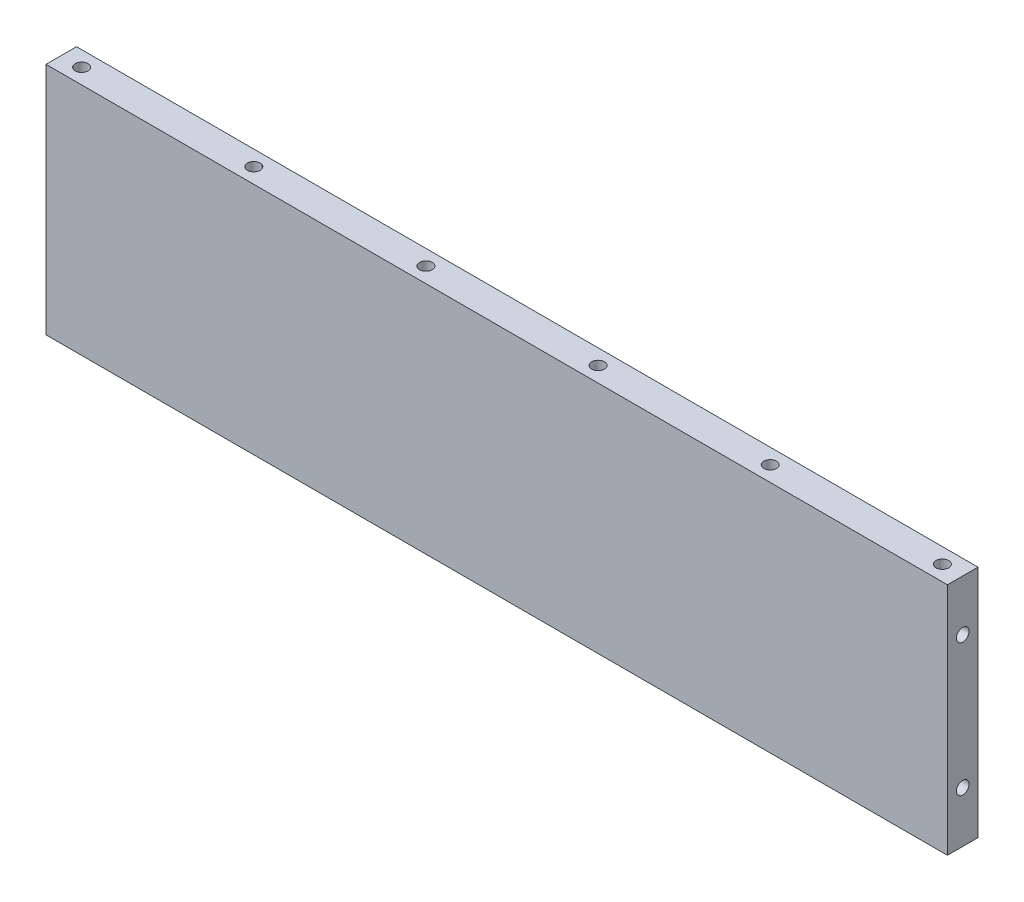
from build123d import *

# Parameters (mm, degrees)
SKETCH_1_W               = 177
SKETCH_1_H               = 46
EXTRUDE_1_DEPTH          = 3
M3X0_5_1_D               = 2.5
M3X0_5_1_DEPTH           = 8.5
M3X0_5_1_TIP             = 0.751075774
M3X0_5_1_ON_FACE_2_D     = 2.5
M3X0_5_1_ON_FACE_2_DEPTH = 8.5
M3X0_5_1_ON_FACE_2_TIP   = 0.751075774
M3X0_5_1_ON_FACE_3_D     = 2.5
M3X0_5_1_ON_FACE_3_DEPTH = 8.5
M3X0_5_1_ON_FACE_3_TIP   = 0.751075774
M3X0_5_1_ON_FACE_4_D     = 2.5
M3X0_5_1_ON_FACE_4_DEPTH = 8.5
M3X0_5_1_ON_FACE_4_TIP   = 0.751075774
CUT_EXTRUDE_1_DEPTH      = 4.8
FILLET_1_R               = 1.1


with BuildPart() as part:
    # ｽｹｯﾁ1 → ﾎﾞｽ - 押し出し1 (new, symmetric)
    with BuildSketch(Plane.XY):
        Rectangle(SKETCH_1_W, SKETCH_1_H)
    extrude(amount=EXTRUDE_1_DEPTH, both=True)

    # M3x0.5 ねじ穴1
    with Locations(Plane(origin=(84.5, -23, 0), x_dir=(0, 0, -1), z_dir=(0, -1, 0))):
        with Locations((0, 0), (0, -33.8), (0, -67.6), (0, -101.4), (0, -135.2), (0, -169)):
            Hole(M3X0_5_1_D / 2, depth=M3X0_5_1_DEPTH)
            with Locations((0, 0, -(M3X0_5_1_DEPTH + M3X0_5_1_TIP / 2))):  # 118° drill point
                Cone(0, M3X0_5_1_D / 2, M3X0_5_1_TIP, mode=Mode.SUBTRACT)

    # M3x0.5 ねじ穴1 on face 2
    with Locations(Plane(origin=(-88.5, -13, 0), x_dir=(0, 0, -1), z_dir=(-1, 0, 0))):
        with Locations((0, 0), (0, -26)):
            Hole(M3X0_5_1_ON_FACE_2_D / 2, depth=M3X0_5_1_ON_FACE_2_DEPTH)
            with Locations((0, 0, -(M3X0_5_1_ON_FACE_2_DEPTH + M3X0_5_1_ON_FACE_2_TIP / 2))):  # 118° drill point
                Cone(0, M3X0_5_1_ON_FACE_2_D / 2, M3X0_5_1_ON_FACE_2_TIP, mode=Mode.SUBTRACT)

    # M3x0.5 ねじ穴1 on face 3
    with Locations(Plane(origin=(-50.7, 23, 0), x_dir=(0, 0, 1), z_dir=(0, 1, 0))):
        with Locations((0, 0), (0, 33.8), (0, -33.8), (0, 67.6), (0, 101.4), (0, 135.2)):
            Hole(M3X0_5_1_ON_FACE_3_D / 2, depth=M3X0_5_1_ON_FACE_3_DEPTH)
            with Locations((0, 0, -(M3X0_5_1_ON_FACE_3_DEPTH + M3X0_5_1_ON_FACE_3_TIP / 2))):  # 118° drill point
                Cone(0, M3X0_5_1_ON_FACE_3_D / 2, M3X0_5_1_ON_FACE_3_TIP, mode=Mode.SUBTRACT)

    # M3x0.5 ねじ穴1 on face 4
    with Locations(Plane(origin=(88.5, 13, 0), x_dir=(0, 0, 1), z_dir=(1, 0, 0))):
        with Locations((0, 0), (0, 26)):
            Hole(M3X0_5_1_ON_FACE_4_D / 2, depth=M3X0_5_1_ON_FACE_4_DEPTH)
            with Locations((0, 0, -(M3X0_5_1_ON_FACE_4_DEPTH + M3X0_5_1_ON_FACE_4_TIP / 2))):  # 118° drill point
                Cone(0, M3X0_5_1_ON_FACE_4_D / 2, M3X0_5_1_ON_FACE_4_TIP, mode=Mode.SUBTRACT)

    # ｽｹｯﾁ4 → ｶｯﾄ - 押し出し1 (cut)
    with BuildSketch(Plane(origin=(0, 0, -3), x_dir=(-1, 0, 0), z_dir=(0, 0, -1))):
        with BuildLine():
            Line((76.5, 11.25), (76.5, 14.436380746))
            ThreePointArc((76.5, 14.436380746), (76.104208513, 15.257667067), (75.215216721, 15.459795038))
            Line((75.215216721, 15.459795038), (7.826366557, 0))
            Line((7.826366557, 0), (75.215216721, -15.459795038))
            ThreePointArc((75.215216721, -15.459795038), (76.104208513, -15.257667067), (76.5, -14.436380746))
            Line((76.5, -14.436380746), (76.5, -11.25))
            Line((76.5, -11.25), (85, -11.25))
            Line((85, -11.25), (85, 11.25))
            Line((85, 11.25), (76.5, 11.25))
        make_face()
        Polygon((48.95, 13.025166445), (0, 1.795460563), (-48.95, 13.025166445), (-48.95, 19.5), (-18.65, 19.5), (-18.65, 11), (-15.15, 11), (-15.15, 19.5), (15.15, 19.5), (15.15, 11), (18.65, 11), (18.65, 19.5), (48.95, 19.5), align=None)
        Polygon((77.173633443, 19.5), (52.45, 19.5), (52.45, 13.828107622), align=None)
        with BuildLine():
            Line((-85, 11.25), (-85, -11.25))
            Line((-85, -11.25), (-76.5, -11.25))
            Line((-76.5, -11.25), (-76.5, -14.436380746))
            ThreePointArc((-76.5, -14.436380746), (-76.104208513, -15.257667067), (-75.215216721, -15.459795038))
            Line((-75.215216721, -15.459795038), (-7.826366557, 0))
            Line((-7.826366557, 0), (-75.215216721, 15.459795038))
            ThreePointArc((-75.215216721, 15.459795038), (-76.104208513, 15.257667067), (-76.5, 14.436380746))
            Line((-76.5, 14.436380746), (-76.5, 11.25))
            Line((-76.5, 11.25), (-85, 11.25))
        make_face()
        Polygon((-77.173633443, -19.5), (-52.45, -19.5), (-52.45, -13.828107622), align=None)
        Polygon((-52.45, 19.5), (-77.173633443, 19.5), (-52.45, 13.828107622), align=None)
        Polygon((0, -1.795460563), (-48.95, -13.025166445), (-48.95, -19.5), (-18.65, -19.5), (-18.65, -11), (-15.15, -11), (-15.15, -19.5), (15.15, -19.5), (15.15, -11), (18.65, -11), (18.65, -19.5), (48.95, -19.5), (48.95, -13.025166445), align=None)
        Polygon((52.45, -19.5), (52.45, -13.828107622), (77.173633443, -19.5), align=None)
    extrude(amount=-CUT_EXTRUDE_1_DEPTH, mode=Mode.SUBTRACT)

    # ﾌｨﾚｯﾄ1
    fillet_1_edges = [part.edges().sort_by_distance(p)[0] for p in [
        (-76.5, 11.25, -0.6),
        (-85, 11.25, -0.6),
        (-85, -11.25, -0.6),
        (-76.5, -11.25, -0.6),
        (-7.826366557, 0, -0.6),
        (52.45, 13.828107622, -0.6),
        (77.173633443, 19.5, -0.6),
        (52.45, 19.5, -0.6),
        (-15.15, 19.5, -0.6),
        (-15.15, 11, -0.6),
        (-18.65, 11, -0.6),
        (-18.65, 19.5, -0.6),
        (-48.95, 19.5, -0.6),
        (-48.95, 13.025166445, -0.6),
        (0, 1.795460563, -0.6),
        (48.95, 13.025166445, -0.6),
        (48.95, 19.5, -0.6),
        (18.65, 19.5, -0.6),
        (18.65, 11, -0.6),
        (15.15, 11, -0.6),
        (15.15, 19.5, -0.6),
        (-77.173633443, 19.5, -0.6),
        (-52.45, 13.828107622, -0.6),
        (-52.45, 19.5, -0.6),
        (-18.65, -11, -0.6),
        (-15.15, -11, -0.6),
        (-15.15, -19.5, -0.6),
        (15.15, -19.5, -0.6),
        (15.15, -11, -0.6),
        (18.65, -11, -0.6),
        (18.65, -19.5, -0.6),
        (48.95, -19.5, -0.6),
        (48.95, -13.025166445, -0.6),
        (0, -1.795460563, -0.6),
        (-48.95, -13.025166445, -0.6),
        (-48.95, -19.5, -0.6),
        (-18.65, -19.5, -0.6),
        (52.45, -13.828107622, -0.6),
        (52.45, -19.5, -0.6),
        (77.173633443, -19.5, -0.6),
        (-52.45, -13.828107622, -0.6),
        (-77.173633443, -19.5, -0.6),
        (-52.45, -19.5, -0.6),
        (7.826366557, 0, -0.6),
        (76.5, -11.25, -0.6),
        (85, -11.25, -0.6),
        (85, 11.25, -0.6),
        (76.5, 11.25, -0.6),
    ]]
    fillet(fillet_1_edges, radius=FILLET_1_R)


solid = part.part
